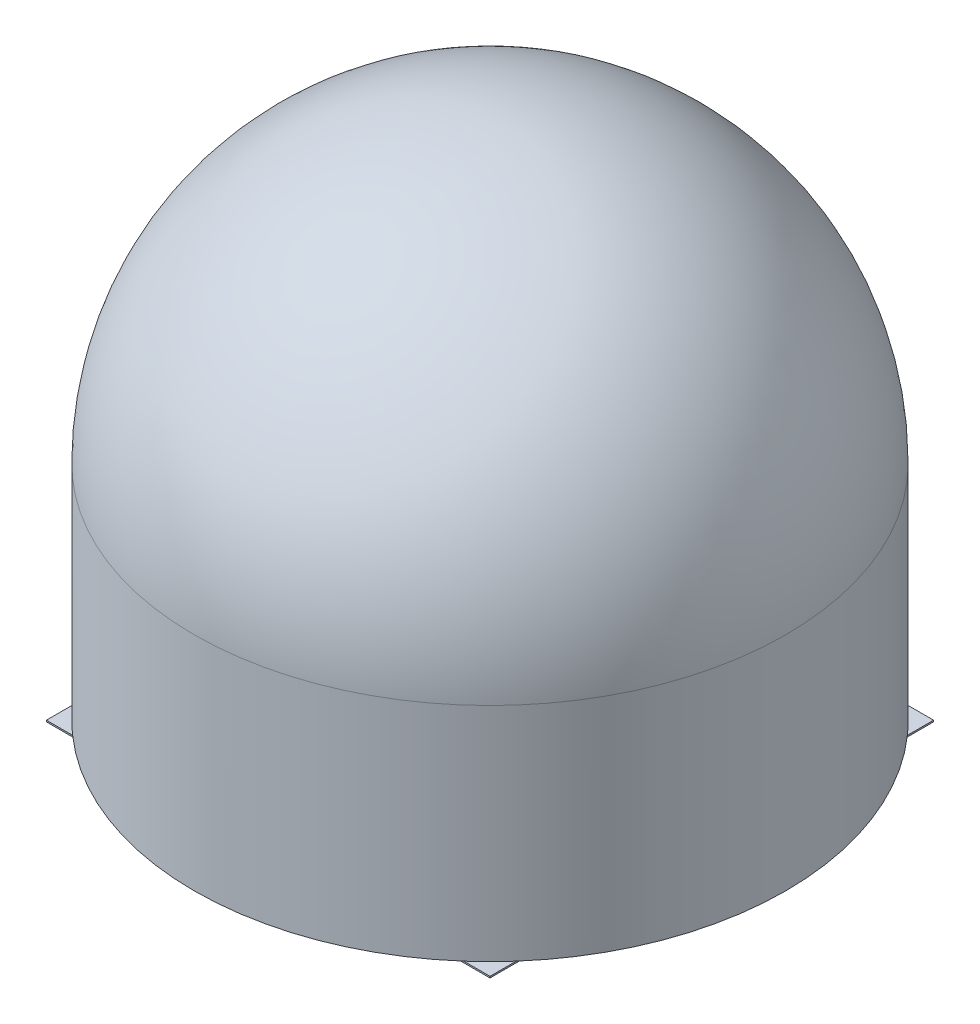
from build123d import *

# Parameters (mm, degrees)
SKETCH2_R           = 200
BOSS_EXTRUDE1_DEPTH = 150
DOME2_FACE_RADIUS   = 200
DOME2_HEIGHT        = 200
SKETCH4_W           = 300
SKETCH4_H           = 300
BOSS_EXTRUDE2_DEPTH = 1


with BuildPart() as part:
    # Sketch2 → Boss-Extrude1 (new body)
    with BuildSketch(Plane(origin=(0, 0, 0), x_dir=(1, 0, 0), z_dir=(0, 1, 0))):
        with Locations(Location((0, 0, 0), (0, 0, 270))):
            Circle(SKETCH2_R)
    extrude(amount=BOSS_EXTRUDE1_DEPTH)

    # Dome2: a dome of height H over a round flat face of radius A is a cap of a sphere of radius (A * A + H * H) / (2 * H)
    dome2_r = (DOME2_FACE_RADIUS * DOME2_FACE_RADIUS + DOME2_HEIGHT * DOME2_HEIGHT) / (2 * DOME2_HEIGHT)
    dome2_base = Plane((0, 150, 0), z_dir=(0, 1, 0))
    with Locations(dome2_base.offset(DOME2_HEIGHT - dome2_r)):
        dome2_ball = Sphere(dome2_r, mode=Mode.PRIVATE)
    add(split(dome2_ball, bisect_by=dome2_base, keep=Keep.TOP, mode=Mode.PRIVATE))

    # Sketch4 → Boss-Extrude2 (add)
    with BuildSketch(Plane.XZ):
        Rectangle(SKETCH4_W, SKETCH4_H)
    extrude(amount=BOSS_EXTRUDE2_DEPTH)


solid = part.part
